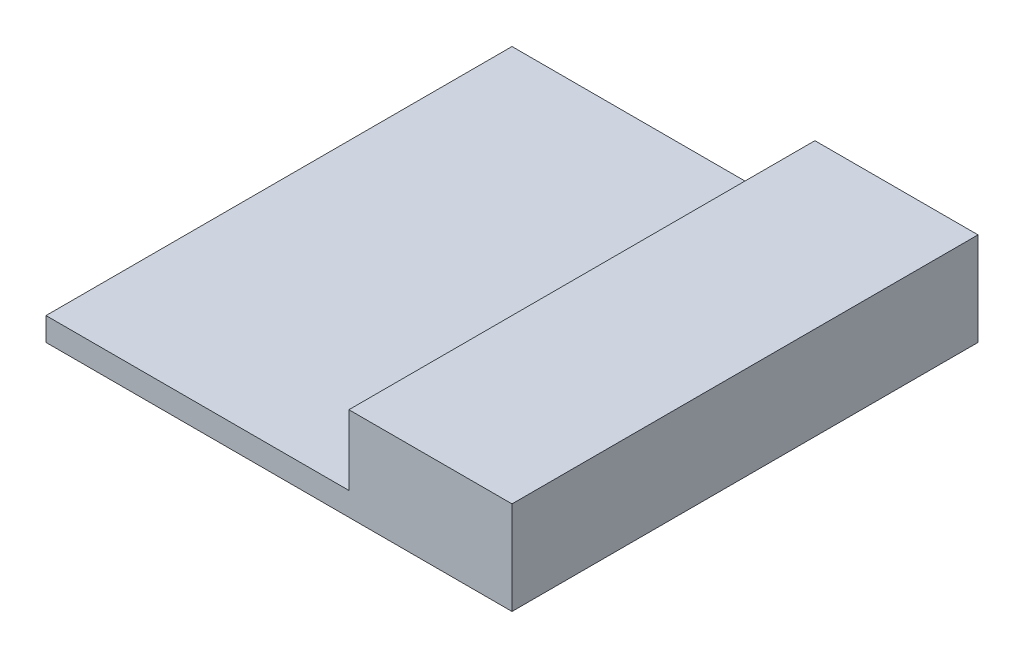
from build123d import *

# Parameters (mm, degrees)
SKETCH_1_W      = 100
SKETCH_1_H      = 100
EXTRUDE_1_DEPTH = 5
SKETCH_2_W      = 35
SKETCH_2_H      = 100
EXTRUDE_2_DEPTH = 15


with BuildPart() as part:
    # 草图1 → 凸台-拉伸1 (new body)
    with BuildSketch(Plane(origin=(0, 0, 0), x_dir=(1, 0, 0), z_dir=(0, 1, 0))):
        with Locations((50, -50)):
            Rectangle(SKETCH_1_W, SKETCH_1_H)
    extrude(amount=EXTRUDE_1_DEPTH)

    # 草图2 → 凸台-拉伸2 (add)
    with BuildSketch(Plane(origin=(0, 5, 0), x_dir=(1, 0, 0), z_dir=(0, 1, 0))):
        with Locations((82.5, -50)):
            Rectangle(SKETCH_2_W, SKETCH_2_H)
    extrude(amount=EXTRUDE_2_DEPTH)


solid = part.part
